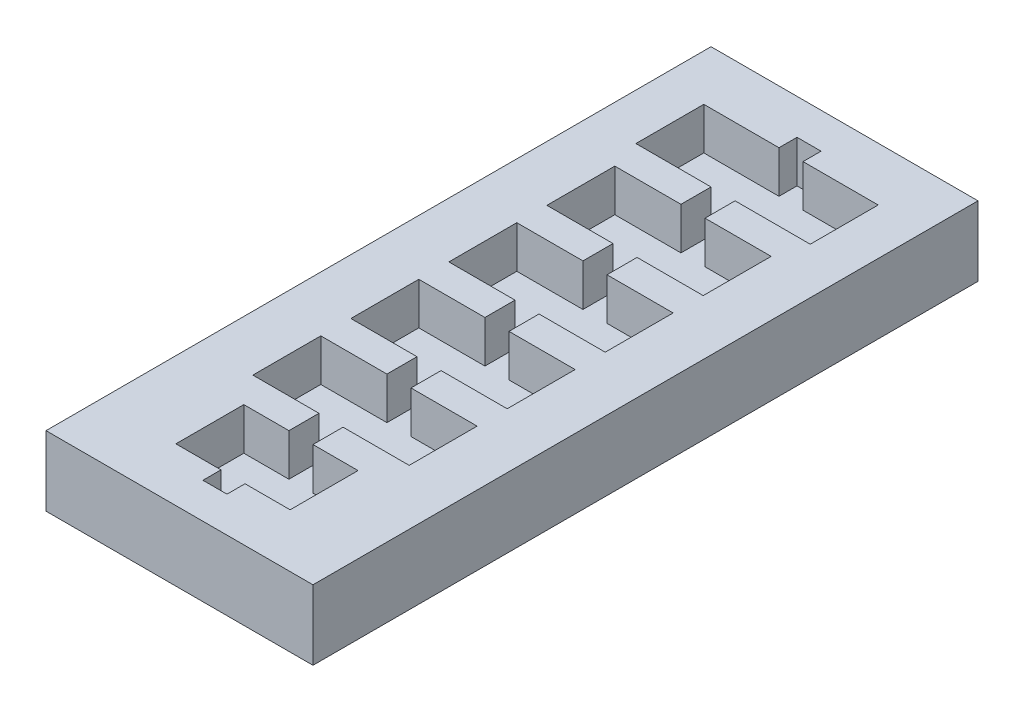
from build123d import *

# Parameters (mm, degrees)
SKETCH_1_W          = 444
SKETCH_1_H          = 1106
EXTRUDE_305_DEPTH   = 116
CUT_EXTRUDE_1_DEPTH = 70


with BuildPart() as part:
    # Эскиз1 → Extrude 305 (new body)
    with BuildSketch(Plane(origin=(0, 0, 0), x_dir=(1, 0, 0), z_dir=(0, 1, 0))):
        with Locations((222, 553)):
            Rectangle(SKETCH_1_W, SKETCH_1_H)
    extrude(amount=-EXTRUDE_305_DEPTH)

    # Эскиз2 → Вырез-Вытянуть1 (cut)
    with BuildSketch(Plane(origin=(0, 0, 0), x_dir=(1, 0, 0), z_dir=(0, 1, 0))):
        Polygon((242, 1047), (202, 1047), (202, 1017), (77, 1017), (77, 904), (202, 904), (202, 854), (92, 854), (92, 741), (202, 741), (202, 691), (92, 691), (92, 578), (202, 578), (202, 528), (92, 528), (92, 415), (202, 415), (202, 365), (92, 365), (92, 252), (202, 252), (202, 202), (127, 202), (127, 89), (202, 89), (202, 59), (242, 59), (242, 89), (317, 89), (317, 202), (242, 202), (242, 252), (352, 252), (352, 365), (242, 365), (242, 415), (352, 415), (352, 528), (242, 528), (242, 578), (352, 578), (352, 691), (242, 691), (242, 741), (352, 741), (352, 854), (242, 854), (242, 904), (367, 904), (367, 1017), (242, 1017), align=None)
    extrude(amount=-CUT_EXTRUDE_1_DEPTH, mode=Mode.SUBTRACT)


solid = part.part
